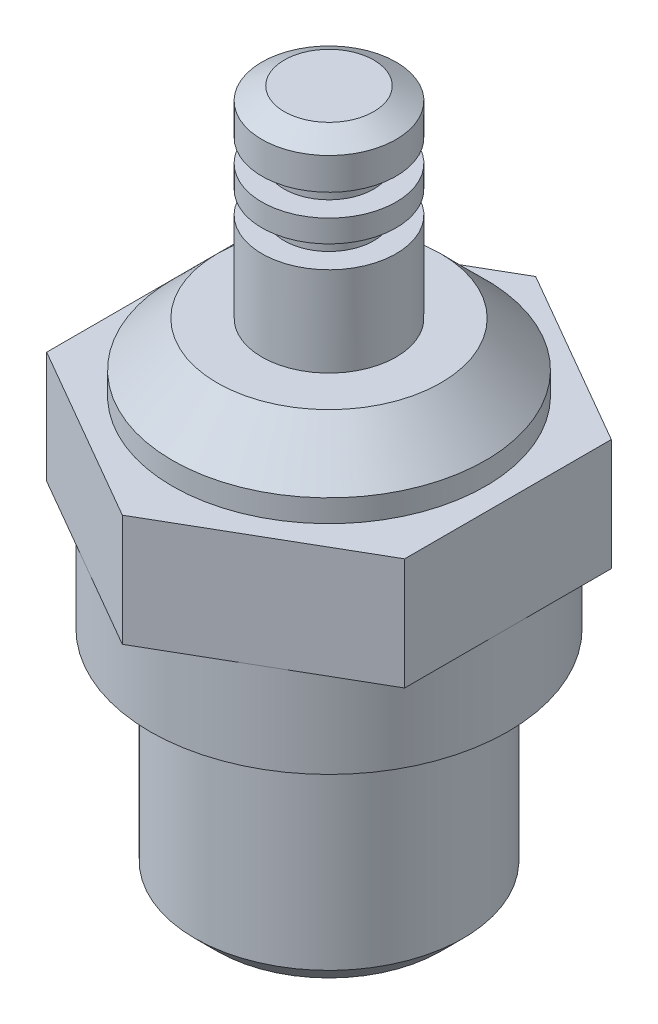
from build123d import *

# Parameters (mm, degrees)
BOSS_EXTRUDE5_DEPTH  = 2.5
SKETCH6_R            = 4
BOSS_EXTRUDE6_DEPTH  = 2
SKETCH7_R            = 3
BOSS_EXTRUDE7_DEPTH  = 5
SKETCH8_R            = 1.5
CUT_EXTRUDE1_DEPTH   = 4
SKETCH9_R            = 1.5
BOSS_EXTRUDE8_DEPTH  = 3.5
SKETCH10_R           = 3.5
BOSS_EXTRUDE9_DEPTH  = 0.5
SKETCH11_R           = 3.5
BOSS_EXTRUDE10_DEPTH = 1
BOSS_EXTRUDE10_TAPER = 45
BOSS_EXTRUDE11_START = -4
SKETCH12_R           = 1.5
BOSS_EXTRUDE11_DEPTH = 11.5
CUT_EXTRUDE2_START   = -13
SKETCH13_R           = 1.5
SKETCH13_R_2         = 1
CUT_EXTRUDE2_DEPTH   = 0.5
CUT_EXTRUDE3_START   = -0.5
SKETCH14_R           = 1.5
SKETCH14_R_2         = 1
CUT_EXTRUDE3_DEPTH   = 0.5
CHAMFER1_SIZE        = 0.288675135
CHAMFER1_SIZE2       = 0.5
CHAMFER2_SIZE        = 0.5


with BuildPart() as part:
    # Sketch5 → Boss-Extrude5 (new body)
    with BuildSketch(Plane(origin=(0, 0, 0), x_dir=(1, 0, 0), z_dir=(0, 1, 0))):
        Polygon((-4, 2.309401077), (-4, -2.309401077), (0, -4.618802154), (4, -2.309401077), (4, 2.309401077), (0, 4.618802154), align=None)
    extrude(amount=BOSS_EXTRUDE5_DEPTH)

    # Sketch6 → Boss-Extrude6 (add)
    with BuildSketch(Plane.XZ):
        with Locations(Location((0, 0, 0), (0, 0, 60))):
            Circle(SKETCH6_R)
    extrude(amount=BOSS_EXTRUDE6_DEPTH)

    # Sketch7 → Boss-Extrude7 (add)
    with BuildSketch(Plane.XZ.offset(2)):
        with Locations(Location((0, 0, 0), (0, 0, 270))):
            Circle(SKETCH7_R)
    extrude(amount=BOSS_EXTRUDE7_DEPTH)

    # Sketch8 → Cut-Extrude1 (cut)
    with BuildSketch(Plane.XZ.offset(7)):
        with Locations(Location((0, 0, 0), (0, 0, 270))):
            Circle(SKETCH8_R)
    extrude(amount=-CUT_EXTRUDE1_DEPTH, mode=Mode.SUBTRACT)

    # Sketch9 → Boss-Extrude8 (add)
    with BuildSketch(Plane(origin=(0, 2.5, 0), x_dir=(1, 0, 0), z_dir=(0, 1, 0))):
        with Locations(Location((0, 0, 0), (0, 0, 90))):
            Circle(SKETCH9_R)
    extrude(amount=BOSS_EXTRUDE8_DEPTH)

    # Sketch10 → Boss-Extrude9 (add)
    with BuildSketch(Plane(origin=(0, 2.5, 0), x_dir=(1, 0, 0), z_dir=(0, 1, 0))):
        with Locations(Location((0, 0, 0), (0, 0, 270))):
            Circle(SKETCH10_R)
    extrude(amount=BOSS_EXTRUDE9_DEPTH)

    # Sketch11 → Boss-Extrude10 (add)
    with BuildSketch(Plane(origin=(0, 3, 0), x_dir=(1, 0, 0), z_dir=(0, 1, 0))):
        with Locations(Location((0, 0, 0), (0, 0, 270))):
            Circle(SKETCH11_R)
    extrude(amount=BOSS_EXTRUDE10_DEPTH, taper=BOSS_EXTRUDE10_TAPER)

    # Sketch12 → Boss-Extrude11 (add)
    with BuildSketch(Plane.XZ.offset(7).offset(BOSS_EXTRUDE11_START)):
        with Locations(Location((0, 0, 0), (0, 0, 270))):
            Circle(SKETCH12_R)
    extrude(amount=-BOSS_EXTRUDE11_DEPTH)

    # Sketch13 → Cut-Extrude2 (cut)
    with BuildSketch(Plane.XZ.offset(7).offset(CUT_EXTRUDE2_START)):
        with Locations(Location((0, 0, 0), (0, 0, 270))):
            Circle(SKETCH13_R)
        with Locations(Location((0, 0, 0), (0, 0, 270))):
            Circle(SKETCH13_R_2, mode=Mode.SUBTRACT)
    extrude(amount=-CUT_EXTRUDE2_DEPTH, mode=Mode.SUBTRACT)

    # Sketch14 → Cut-Extrude3 (cut)
    with BuildSketch(Plane.XZ.offset(-6.5).offset(CUT_EXTRUDE3_START)):
        with Locations(Location((0, 0, 0), (0, 0, 270))):
            Circle(SKETCH14_R)
        with Locations(Location((0, 0, 0), (0, 0, 270))):
            Circle(SKETCH14_R_2, mode=Mode.SUBTRACT)
    extrude(amount=-CUT_EXTRUDE3_DEPTH, mode=Mode.SUBTRACT)

    # Chamfer1
    chamfer1_edges = [part.edges().sort_by_distance(p)[0] for p in [
        (0, 8.5, 1.5),
    ]]
    chamfer1_side = [part.faces().sort_by_distance(p)[0] for p in [
        (0, 8, 1.5),
    ]]
    chamfer(chamfer1_edges, length=CHAMFER1_SIZE, length2=CHAMFER1_SIZE2, reference=chamfer1_side[0])

    # Chamfer2
    chamfer2_edges = [part.edges().sort_by_distance(p)[0] for p in [
        (0, -7, 3),
    ]]
    chamfer(chamfer2_edges, length=CHAMFER2_SIZE)


solid = part.part
